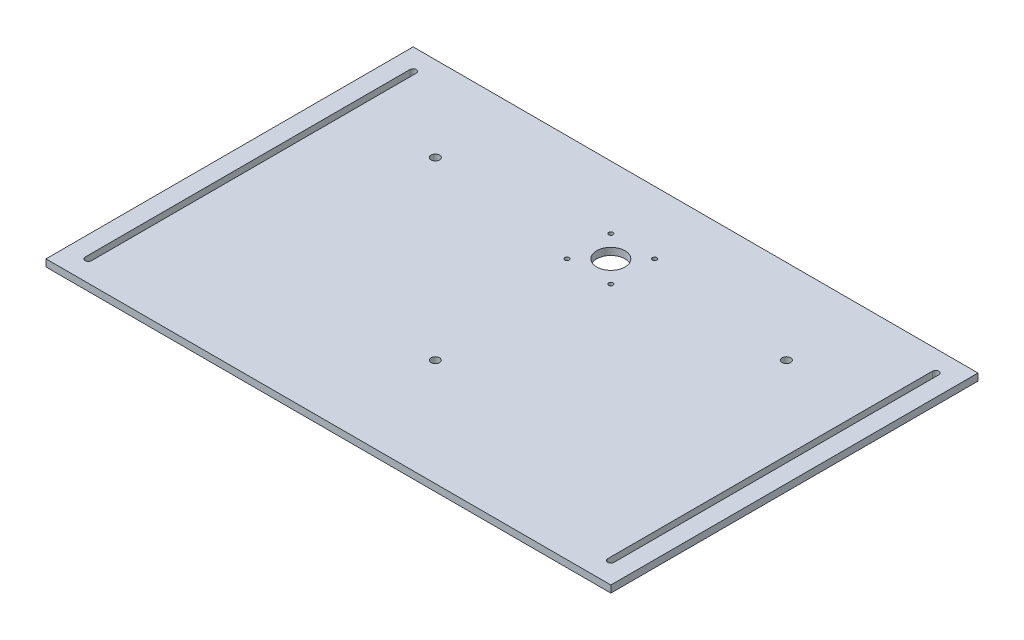
from build123d import *

# Parameters (mm, degrees)
SKETCH_1_W          = 400
SKETCH_1_H          = 260
EXTRUDE_1_DEPTH     = 5
CUT_EXTRUDE_1_DEPTH = 239.589605809
SKETCH_3_R          = 1.55
SKETCH_3_R_2        = 10
SKETCH_3_R_3        = 3
CUT_EXTRUDE_2_DEPTH = 239.589605809


with BuildPart() as part:
    # 草圖1 → 填料-伸長1 (new body)
    with BuildSketch(Plane(origin=(0, 0, 0), x_dir=(1, 0, 0), z_dir=(0, 1, 0))):
        Rectangle(SKETCH_1_W, SKETCH_1_H)
    extrude(amount=EXTRUDE_1_DEPTH)

    # 草圖2 → 除料-伸長1 (cut, through all)
    with BuildSketch(Plane(origin=(0, 5, 0), x_dir=(1, 0, 0), z_dir=(0, 1, 0))):
        with BuildLine():
            Line((-182.75, 115), (-182.75, -115))
            ThreePointArc((-182.75, -115), (-185, -117.25), (-187.25, -115))
            Line((-187.25, -115), (-187.25, 115))
            ThreePointArc((-187.25, 115), (-185, 117.25), (-182.75, 115))
        make_face()
        with BuildLine():
            Line((182.75, 115), (182.75, -115))
            ThreePointArc((182.75, -115), (185, -117.25), (187.25, -115))
            Line((187.25, -115), (187.25, 115))
            ThreePointArc((187.25, 115), (185, 117.25), (182.75, 115))
        make_face()
    extrude(amount=-CUT_EXTRUDE_1_DEPTH, mode=Mode.SUBTRACT)

    # 草圖3 → 除料-伸長2 (cut, through all)
    with BuildSketch(Plane(origin=(0, 5, 0), x_dir=(1, 0, 0), z_dir=(0, 1, 0))):
        with Locations(Location((-15.5, 85.5, 0), (0, 0, 270))):
            Circle(SKETCH_3_R)
        with Locations(Location((15.5, 85.5, 0), (0, 0, 270))):
            Circle(SKETCH_3_R)
        with Locations(Location((-15.5, 54.5, 0), (0, 0, 270))):
            Circle(SKETCH_3_R)
        with Locations(Location((15.5, 54.5, 0), (0, 0, 270))):
            Circle(SKETCH_3_R)
        with Locations(Location((0, 70, 0), (0, 0, 270))):
            Circle(SKETCH_3_R_2)
        with Locations(Location((-124.304765272, 70, 0), (0, 0, 270))):
            Circle(SKETCH_3_R_3)
        with Locations(Location((124.304765272, 70, 0), (0, 0, 90))):
            Circle(SKETCH_3_R_3)
        with Locations(Location((0, -54.304765272, 0), (0, 0, 270))):
            Circle(SKETCH_3_R_3)
    extrude(amount=-CUT_EXTRUDE_2_DEPTH, mode=Mode.SUBTRACT)


solid = part.part
